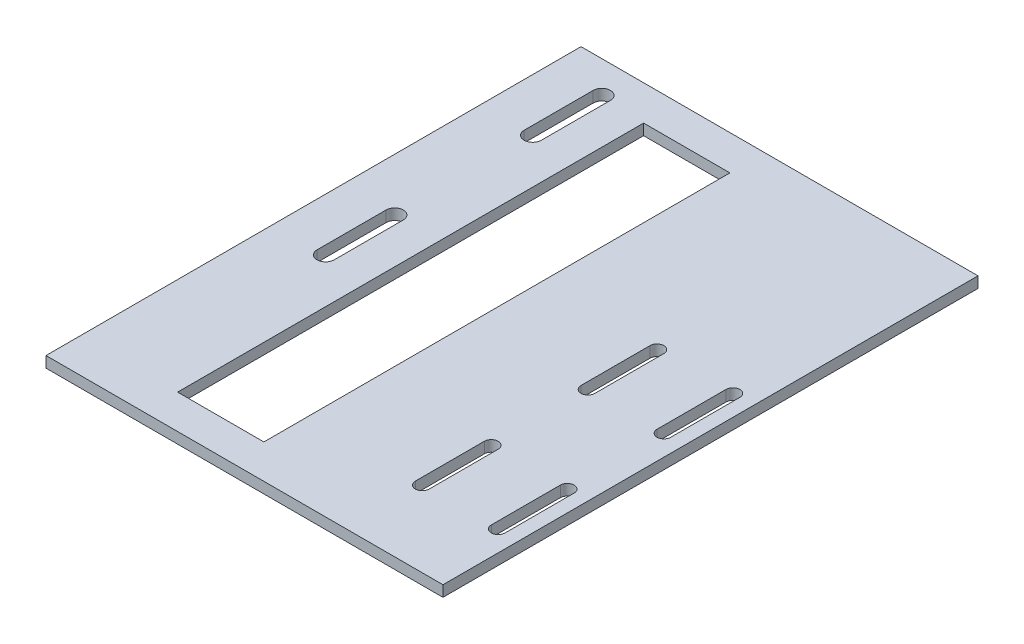
from build123d import *

# Parameters (mm, degrees)
SKETCH1_W           = 25
SKETCH1_H           = 135
BOSS_EXTRUDE1_DEPTH = 3.175


with BuildPart() as part:
    # Sketch1 → Boss-Extrude1 (new body)
    with BuildSketch(Plane(origin=(0, 0, 0), x_dir=(1, 0, 0), z_dir=(0, 1, 0))):
        Polygon((67.674333466, 92.651811553), (67.674333466, -62.348188447), (-47.325666534, -62.348188447), (-47.325666534, -27.044565342), (-47.325666534, 92.651811553), align=None)
        with Locations((-6.586624165, 15.039519235)):
            Rectangle(SKETCH1_W, SKETCH1_H, mode=Mode.SUBTRACT)
        with BuildLine():
            Line((-34.586624165, 63.427366475), (-34.586624165, 83.427366475))
            ThreePointArc((-34.586624165, 83.427366475), (-32.086624165, 85.927366475), (-29.586624165, 83.427366475))
            Line((-29.586624165, 83.427366475), (-29.586624165, 63.427366475))
            ThreePointArc((-29.586624165, 63.427366475), (-32.086624165, 60.927366475), (-34.586624165, 63.427366475))
        make_face(mode=Mode.SUBTRACT)
        with BuildLine():
            Line((-34.586624165, 3.427366475), (-34.586624165, 23.427366475))
            ThreePointArc((-34.586624165, 23.427366475), (-32.086624165, 25.927366475), (-29.586624165, 23.427366475))
            Line((-29.586624165, 23.427366475), (-29.586624165, 3.427366475))
            ThreePointArc((-29.586624165, 3.427366475), (-32.086624165, 0.927366475), (-34.586624165, 3.427366475))
        make_face(mode=Mode.SUBTRACT)
        with BuildLine():
            Line((59.674333466, 7.651811553), (59.674333466, 27.651811553))
            ThreePointArc((59.674333466, 27.651811553), (61.674333466, 29.651811553), (63.674333466, 27.651811553))
            Line((63.674333466, 27.651811553), (63.674333466, 7.651811553))
            ThreePointArc((63.674333466, 7.651811553), (61.674333466, 5.651811553), (59.674333466, 7.651811553))
        make_face(mode=Mode.SUBTRACT)
        with BuildLine():
            Line((59.674333466, -40.348188447), (59.674333466, -20.348188447))
            ThreePointArc((59.674333466, -20.348188447), (61.674333466, -18.348188447), (63.674333466, -20.348188447))
            Line((63.674333466, -20.348188447), (63.674333466, -40.348188447))
            ThreePointArc((63.674333466, -40.348188447), (61.674333466, -42.348188447), (59.674333466, -40.348188447))
        make_face(mode=Mode.SUBTRACT)
        with BuildLine():
            Line((41.674333466, 7.651811553), (41.674333466, 27.651811553))
            ThreePointArc((41.674333466, 27.651811553), (39.674333466, 29.651811553), (37.674333466, 27.651811553))
            Line((37.674333466, 27.651811553), (37.674333466, 7.651811553))
            ThreePointArc((37.674333466, 7.651811553), (39.674333466, 5.651811553), (41.674333466, 7.651811553))
        make_face(mode=Mode.SUBTRACT)
        with BuildLine():
            Line((41.674333466, -40.348188447), (41.674333466, -20.348188447))
            ThreePointArc((41.674333466, -20.348188447), (39.674333466, -18.348188447), (37.674333466, -20.348188447))
            Line((37.674333466, -20.348188447), (37.674333466, -40.348188447))
            ThreePointArc((37.674333466, -40.348188447), (39.674333466, -42.348188447), (41.674333466, -40.348188447))
        make_face(mode=Mode.SUBTRACT)
    extrude(amount=BOSS_EXTRUDE1_DEPTH)


solid = part.part
